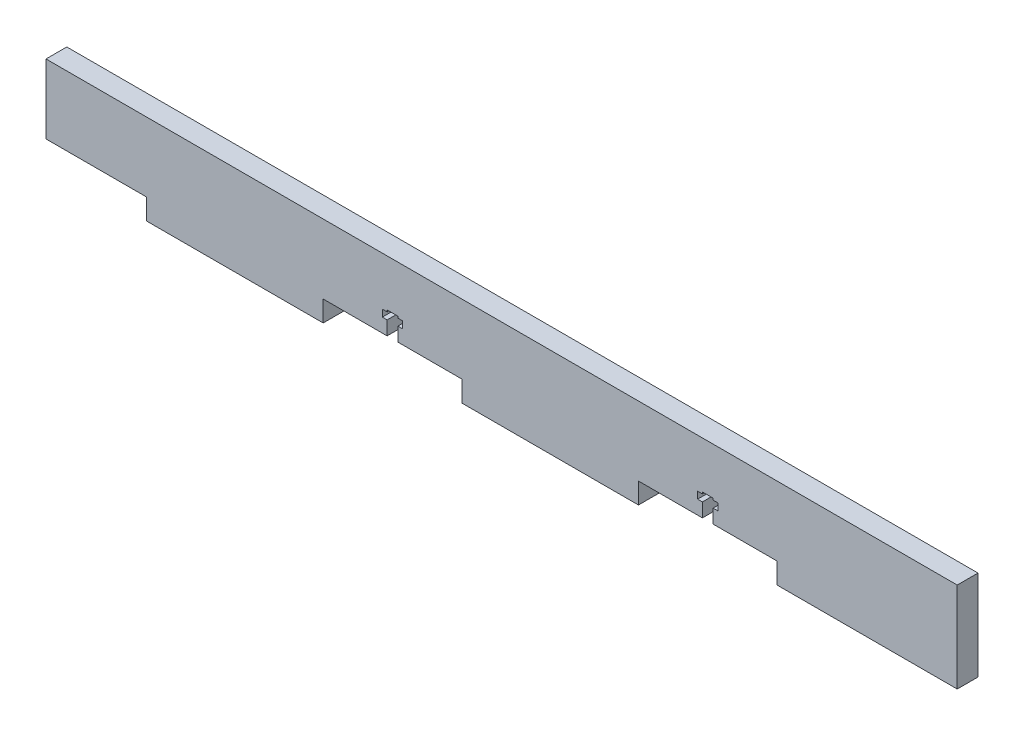
from build123d import *

# Parameters (mm, degrees)
SZKIC1_W                    = 264
SZKIC1_H                    = 26
DODANIE_WYCI_GNI_CIE1_DEPTH = 6
SZKIC5_W                    = 40
SZKIC5_H                    = 6
WYTNIJ_WYCI_GNI_CIE3_DEPTH  = 6
SZYK_LINIOWY1_COUNT         = 3
SZYK_LINIOWY1_PITCH         = 91
WYTNIJ_WYCI_GNI_CIE4_DEPTH  = 6
SZYK_LINIOWY2_COUNT         = 2
SZYK_LINIOWY2_PITCH         = 91
PRZENIE_CIAN_1_BY           = 1


with BuildPart() as part:
    # Szkic1 → Dodanie-wyciągnięcie1 (new body)
    with BuildSketch(Plane.XY):
        with Locations((-747.9, 7)):
            Rectangle(SZKIC1_W, SZKIC1_H)
    extrude(amount=-DODANIE_WYCI_GNI_CIE1_DEPTH)

    # Szkic5 → Wytnij-wyciągnięcie3 (cut)
    with BuildSketch(Plane.XY):
        with Locations((-869.9, -3)):
            Rectangle(SZKIC5_W, SZKIC5_H)
    wytnij_wyci_gni_cie3 = extrude(amount=-WYTNIJ_WYCI_GNI_CIE3_DEPTH, mode=Mode.SUBTRACT)

    # Szyk liniowy1: Wytnij-wyciągnięcie3 ×3
    with Locations(*[(i * SZYK_LINIOWY1_PITCH, 0, 0) for i in range(1, SZYK_LINIOWY1_COUNT)]):
        add(wytnij_wyci_gni_cie3, mode=Mode.SUBTRACT)

    # Szkic6 → Wytnij-wyciągnięcie4 (cut)
    with BuildSketch(Plane.XY):
        Polygon((-777.35, 0), (-780.45, 0), (-780.45, 4), (-781.825, 4), (-781.825, 6), (-780.45, 6), (-780.45, 6.5), (-777.35, 6.5), (-777.35, 6), (-775.975, 6), (-775.975, 4), (-777.35, 4), align=None)
    wytnij_wyci_gni_cie4 = extrude(amount=-WYTNIJ_WYCI_GNI_CIE4_DEPTH, mode=Mode.SUBTRACT)

    # Szyk liniowy2: Wytnij-wyciągnięcie4 ×2
    with Locations(*[(i * SZYK_LINIOWY2_PITCH, 0, 0) for i in range(1, SZYK_LINIOWY2_COUNT)]):
        add(wytnij_wyci_gni_cie4, mode=Mode.SUBTRACT)

    # Przenieś ścianę1: a face moved inward by 1.0
    extrude(part.faces().sort_by_distance((-879.9, 10, -3))[0], amount=PRZENIE_CIAN_1_BY, dir=(1, 0, 0), mode=Mode.SUBTRACT)


solid = part.part
